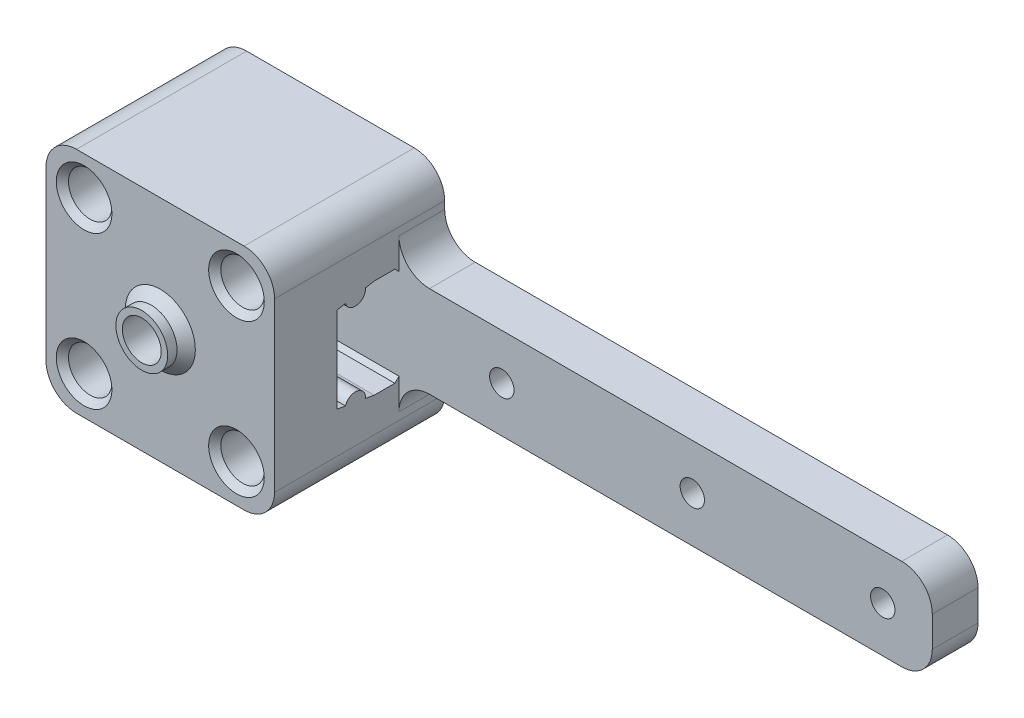
from build123d import *

# Parameters (mm, degrees)
SKETCH1_R                  = 1.6
BOSS_EXTRUDE1_DEPTH        = 6
SKETCH1_3_R                = 1.6
BOSS_EXTRUDE2_DEPTH        = 22.33
CUT_EXTRUDE1_DEPTH         = 22.5
SKETCH3_R                  = 2.55
CUT_EXTRUDE2_DEPTH         = 8
CUT_EXTRUDE3_DEPTH         = 4.5
SKETCH6_R                  = 5
CUT_EXTRUDE5_DEPTH         = 8.6
SKETCH7_R                  = 1.6
CUT_EXTRUDE6_DEPTH         = 101.740403513
SKETCH8_R                  = 2.85
CUT_EXTRUDE7_DEPTH         = 18
BOSS_EXTRUDE3_START        = 2.43
SKETCH9_R                  = 3.4
SKETCH9_R_2                = 2.55
BOSS_EXTRUDE3_DEPTH        = 2.43
CHAMFER1_SIZE              = 1.2
FILLET3_R                  = 4
CHAMFER2_SIZE              = 0.8
CUT_EXTRUDE8_DEPTH         = 3
CHAMFER3_SIZE              = 0.8
LPATTERN1_COUNT            = 3
LPATTERN1_PITCH            = 25
CHAMFER3_OF_LPATTERN1_SIZE = 0.8


with BuildPart() as part:
    # Sketch1 → Boss-Extrude1 (new body)
    with BuildSketch(Plane.XY):
        Polygon((-5, 25), (-5, -5), (25, -5), (25, 4), (95, 4), (95, 16), (25, 16), (25, 25), align=None)
        Circle(SKETCH1_R, mode=Mode.SUBTRACT)
        with Locations((20, 0)):
            Circle(SKETCH1_R, mode=Mode.SUBTRACT)
        with Locations((0, 20)):
            Circle(SKETCH1_R, mode=Mode.SUBTRACT)
        with Locations((20, 20)):
            Circle(SKETCH1_R, mode=Mode.SUBTRACT)
    extrude(amount=BOSS_EXTRUDE1_DEPTH)

    # Sketch1<3> → Boss-Extrude2 (add)
    with BuildSketch(Plane.XY):
        Polygon((-5, 25), (-5, -5), (25, -5), (25, 4), (25, 16), (25, 25), align=None)
        Circle(SKETCH1_3_R, mode=Mode.SUBTRACT)
        with Locations((20, 0)):
            Circle(SKETCH1_3_R, mode=Mode.SUBTRACT)
        with Locations((0, 20)):
            Circle(SKETCH1_3_R, mode=Mode.SUBTRACT)
        with Locations((20, 20)):
            Circle(SKETCH1_3_R, mode=Mode.SUBTRACT)
    extrude(amount=BOSS_EXTRUDE2_DEPTH)

    # Sketch2 → Cut-Extrude1 (cut)
    with BuildSketch(Plane(origin=(25, 0, 0), x_dir=(0, 0, -1), z_dir=(1, 0, 0))):
        with BuildLine():
            Line((-6.54075, 16.488632043), (-9.2445, 16.488632043))
            Line((-9.2445, 16.488632043), (-10.381879417, 16.288081364))
            ThreePointArc((-10.381879417, 16.288081364), (-11.49719937, 14.886920062), (-13.024482689, 15.822119108))
            Line((-13.024482689, 15.822119108), (-14.11125, 15.630492709))
            Line((-14.11125, 15.630492709), (-14.11125, 4.368771376))
            Line((-14.11125, 4.368771376), (-13.024482689, 4.177144977))
            ThreePointArc((-13.024482689, 4.177144977), (-11.49719937, 5.112344024), (-10.381879417, 3.711182721))
            Line((-10.381879417, 3.711182721), (-9.2445, 3.510632043))
            Line((-9.2445, 3.510632043), (-6.54075, 3.510632043))
            Line((-6.54075, 3.510632043), (-6, 4.051382043))
            Line((-6, 4.051382043), (-6, 15.947882043))
            Line((-6, 15.947882043), (-6.54075, 16.488632043))
        make_face()
    extrude(amount=-CUT_EXTRUDE1_DEPTH, mode=Mode.SUBTRACT)

    # Sketch3 → Cut-Extrude2 (cut)
    with BuildSketch(Plane.XY.offset(22.33)):
        with Locations((10, 10)):
            Circle(SKETCH3_R)
    extrude(amount=-CUT_EXTRUDE2_DEPTH, mode=Mode.SUBTRACT)

    # Sketch5 → Cut-Extrude3 (cut)
    with BuildSketch(Plane(origin=(0, 0, 14.11125), x_dir=(-1, 0, 0), z_dir=(0, 0, -1))):
        Polygon((-5.32346282, 10), (-7.66173141, 14.05), (-12.33826859, 14.05), (-14.67653718, 10), (-12.33826859, 5.95), (-7.66173141, 5.95), align=None)
    extrude(amount=-CUT_EXTRUDE3_DEPTH, mode=Mode.SUBTRACT)

    # Sketch6 → Cut-Extrude5 (cut)
    with BuildSketch(Plane(origin=(0, 0, 0), x_dir=(-1, 0, 0), z_dir=(0, 0, -1))):
        with Locations((-10, 10)):
            Circle(SKETCH6_R)
    extrude(amount=-CUT_EXTRUDE5_DEPTH, mode=Mode.SUBTRACT)

    # Sketch7 → Cut-Extrude6 (cut, through all)
    with BuildSketch(Plane(origin=(0, 0, 0), x_dir=(-1, 0, 0), z_dir=(0, 0, -1))):
        with Locations((-88.5, 10)):
            Circle(SKETCH7_R)
        with Locations((-38.5, 10)):
            Circle(SKETCH7_R)
        with Locations((-63.5, 10)):
            Circle(SKETCH7_R)
    extrude(amount=-CUT_EXTRUDE6_DEPTH, mode=Mode.SUBTRACT)

    # Sketch8 → Cut-Extrude7 (cut)
    with BuildSketch(Plane.XY.offset(22.33)):
        with Locations((20, 20)):
            Circle(SKETCH8_R)
        with Locations((20, 0)):
            Circle(SKETCH8_R)
        Circle(SKETCH8_R)
        with Locations((0, 20)):
            Circle(SKETCH8_R)
    extrude(amount=-CUT_EXTRUDE7_DEPTH, mode=Mode.SUBTRACT)

    # Sketch9 → Boss-Extrude3 (add)
    with BuildSketch(Plane.XY.offset(22.33).offset(BOSS_EXTRUDE3_START)):
        with Locations((10, 10)):
            Circle(SKETCH9_R)
        with Locations((10, 10)):
            Circle(SKETCH9_R_2, mode=Mode.SUBTRACT)
    extrude(amount=-BOSS_EXTRUDE3_DEPTH)

    # Chamfer1
    chamfer1_edges = [part.edges().sort_by_distance(p)[0] for p in [
        (6.6, 10, 22.33),
    ]]
    chamfer(chamfer1_edges, length=CHAMFER1_SIZE)

    # Fillet3
    fillet3_edges = [part.edges().sort_by_distance(p)[0] for p in [
        (25, 4, 3),
        (25, 16, 3),
        (25, 25, 11.165),
        (-5, 25, 11.165),
        (-5, -5, 11.165),
        (25, -5, 11.165),
        (95, 4, 3),
        (95, 16, 3),
    ]]
    fillet(fillet3_edges, radius=FILLET3_R)

    # Chamfer2
    chamfer2_edges = [part.edges().sort_by_distance(p)[0] for p in [
        (17.15, 0, 22.33),
        (-2.85, 0, 22.33),
        (-2.85, 20, 22.33),
        (17.15, 20, 22.33),
    ]]
    chamfer(chamfer2_edges, length=CHAMFER2_SIZE)

    # Sketch10 → Cut-Extrude8 (cut)
    with BuildSketch(Plane(origin=(0, 0, 0), x_dir=(-1, 0, 0), z_dir=(0, 0, -1))):
        Polygon((-85.266838493, 10), (-86.883419246, 12.8), (-90.116580754, 12.8), (-91.733161507, 10), (-90.116580754, 7.2), (-86.883419246, 7.2), align=None)
    cut_extrude8 = extrude(amount=-CUT_EXTRUDE8_DEPTH, mode=Mode.SUBTRACT)

    # Chamfer3
    chamfer3_edges = [part.edges().sort_by_distance(p)[0] for p in [
        (86.075128869, 8.6, 0),
        (88.5, 7.2, 0),
        (90.924871131, 8.6, 0),
        (90.924871131, 11.4, 0),
        (86.075128869, 11.4, 0),
        (88.5, 12.8, 0),
    ]]
    chamfer(chamfer3_edges, length=CHAMFER3_SIZE)

    # LPattern1: Cut-Extrude8 ×3
    with Locations(*[(-i * LPATTERN1_PITCH, 0, 0) for i in range(1, LPATTERN1_COUNT)]):
        add(cut_extrude8, mode=Mode.SUBTRACT)

    # Chamfer3 of LPattern1
    chamfer3_of_lpattern1_edges = [part.edges().sort_by_distance(p)[0] for p in [
        (61.075128869, 8.6, 0),
        (63.5, 7.2, 0),
        (65.924871131, 8.6, 0),
        (65.924871131, 11.4, 0),
        (61.075128869, 11.4, 0),
        (63.5, 12.8, 0),
        (36.075128869, 8.6, 0),
        (38.5, 7.2, 0),
        (40.924871131, 8.6, 0),
        (40.924871131, 11.4, 0),
        (36.075128869, 11.4, 0),
        (38.5, 12.8, 0),
    ]]
    chamfer(chamfer3_of_lpattern1_edges, length=CHAMFER3_OF_LPATTERN1_SIZE)


solid = part.part
